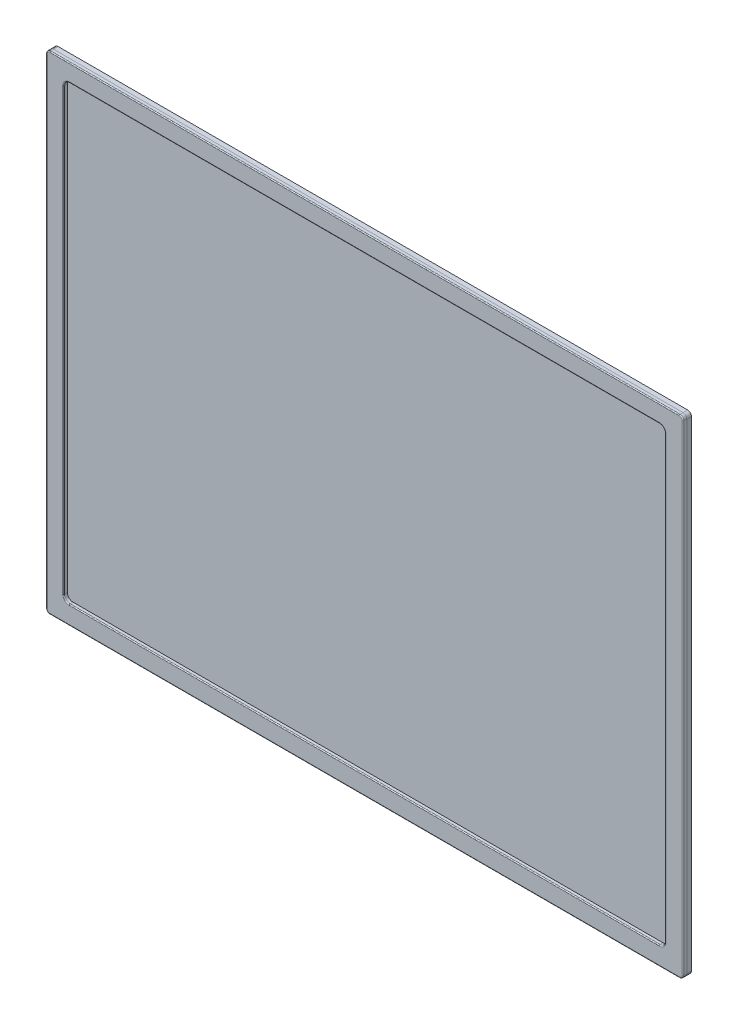
from build123d import *

# Parameters (mm, degrees)
BOSS_EXTRUDE1_DEPTH = 203.2
FILLET1_R           = 50.8
BOSS_EXTRUDE2_DEPTH = 254


with BuildPart() as part:
    # Model → Boss-Extrude1 (new body)
    with BuildSketch(Plane.XY):
        with BuildLine():
            Line((41630.6, -357.010766602), (7137.4, -357.010766602))
            add(Edge.make_bspline(
                [(7137.4, -357.010766602), (7025.639379883, -357.010766602), (6934.2, -448.450146484), (6934.2, -560.210766602)],
                knots=[1, 1, 1, 1, 2, 2, 2, 2], degree=3))
            Line((6934.2, -560.210766602), (6934.2, -26873.2))
            add(Edge.make_bspline(
                [(6934.2, -26873.2), (6934.2, -26984.957519531), (7025.639379883, -27076.4), (7137.4, -27076.4)],
                knots=[3, 3, 3, 3, 4, 4, 4, 4], degree=3))
            Line((7137.4, -27076.4), (41630.6, -27076.4))
            add(Edge.make_bspline(
                [(41630.6, -27076.4), (41742.360620117, -27076.4), (41833.8, -26984.957519531), (41833.8, -26873.2)],
                knots=[5, 5, 5, 5, 6, 6, 6, 6], degree=3))
            Line((41833.8, -26873.2), (41833.8, -560.210766602))
            add(Edge.make_bspline(
                [(41833.8, -560.210766602), (41833.8, -448.450146484), (41742.360620117, -357.010766602), (41630.6, -357.010766602)],
                knots=[7, 7, 7, 7, 8, 8, 8, 8], degree=3))
        make_face()
        with BuildLine():
            Line((40538.4, -26060.4), (8204.2, -26060.4))
            add(Edge.make_bspline(
                [(8204.2, -26060.4), (8036.560620117, -26060.4), (7899.4, -25923.239379883), (7899.4, -25755.6)],
                knots=[2, 2, 2, 2, 3, 3, 3, 3], degree=3))
            Line((7899.4, -25755.6), (7899.4, -1627.010766602))
            add(Edge.make_bspline(
                [(7899.4, -1627.010766602), (7899.4, -1459.371386719), (8036.560620117, -1322.210766602), (8204.2, -1322.210766602)],
                knots=[4, 4, 4, 4, 5, 5, 5, 5], degree=3))
            Line((8204.2, -1322.210766602), (40538.4, -1322.210766602))
            add(Edge.make_bspline(
                [(40538.4, -1322.210766602), (40706.039379883, -1322.210766602), (40843.2, -1459.371386719), (40843.2, -1627.010766602)],
                knots=[6, 6, 6, 6, 7, 7, 7, 7], degree=3))
            Line((40843.2, -1627.010766602), (40843.2, -25755.6))
            add(Edge.make_bspline(
                [(40843.2, -25755.6), (40843.2, -25923.239379883), (40706.039379883, -26060.4), (40538.4, -26060.4)],
                knots=[0, 0, 0, 0, 1, 1, 1, 1], degree=3))
        make_face(mode=Mode.SUBTRACT)
    extrude(amount=BOSS_EXTRUDE1_DEPTH)

    # Fillet1
    fillet1_edges = [part.edges().sort_by_distance(p)[0] for p in [
        (6993.890366848, -27016.70966922, 203.2),
        (24384, -27076.4, 203.2),
        (41774.109633189, -27016.709669183, 203.2),
        (41833.8, -13716.705383301, 203.2),
        (41774.110232526, -416.700534039, 203.2),
        (40753.664767429, -25970.864767483, 203.2),
        (40843.2, -13691.305383301, 203.2),
        (40753.664767483, -1411.745999173, 203.2),
        (24371.3, -1322.210766602, 203.2),
        (7988.935232571, -1411.745999118, 203.2),
        (7899.4, -13691.305383301, 203.2),
        (7988.935232517, -25970.864767429, 203.2),
        (24384, -357.010766602, 203.2),
        (24371.3, -26060.4, 203.2),
        (6993.889767438, -416.700534076, 203.2),
        (6934.2, -13716.705383301, 203.2),
    ]]
    fillet(fillet1_edges, radius=FILLET1_R)


with BuildPart() as body_2:
    # Sketch4 → Boss-Extrude2 (new body)
    with BuildSketch(Plane.XY):
        with BuildLine():
            Line((41630.6, -357.010766602), (7137.4, -357.010766602))
            add(Edge.make_bspline(
                [(7137.4, -357.010766602), (7025.639379883, -357.010766602), (6934.2, -448.450146484), (6934.2, -560.210766602)],
                knots=[1, 1, 1, 1, 2, 2, 2, 2], degree=3))
            Line((6934.2, -560.210766602), (6934.2, -26873.2))
            add(Edge.make_bspline(
                [(6934.2, -26873.2), (6934.2, -26984.957519531), (7025.639379883, -27076.4), (7137.4, -27076.4)],
                knots=[3, 3, 3, 3, 4, 4, 4, 4], degree=3))
            Line((7137.4, -27076.4), (41630.6, -27076.4))
            add(Edge.make_bspline(
                [(41630.6, -27076.4), (41742.360620117, -27076.4), (41833.8, -26984.957519531), (41833.8, -26873.2)],
                knots=[5, 5, 5, 5, 6, 6, 6, 6], degree=3))
            Line((41833.8, -26873.2), (41833.8, -560.210766602))
            add(Edge.make_bspline(
                [(41833.8, -560.210766602), (41833.8, -448.450146484), (41742.360620117, -357.010766602), (41630.6, -357.010766602)],
                knots=[7, 7, 7, 7, 8, 8, 8, 8], degree=3))
        make_face()
    extrude(amount=-BOSS_EXTRUDE2_DEPTH)


solid = Compound([part.part, body_2.part])
